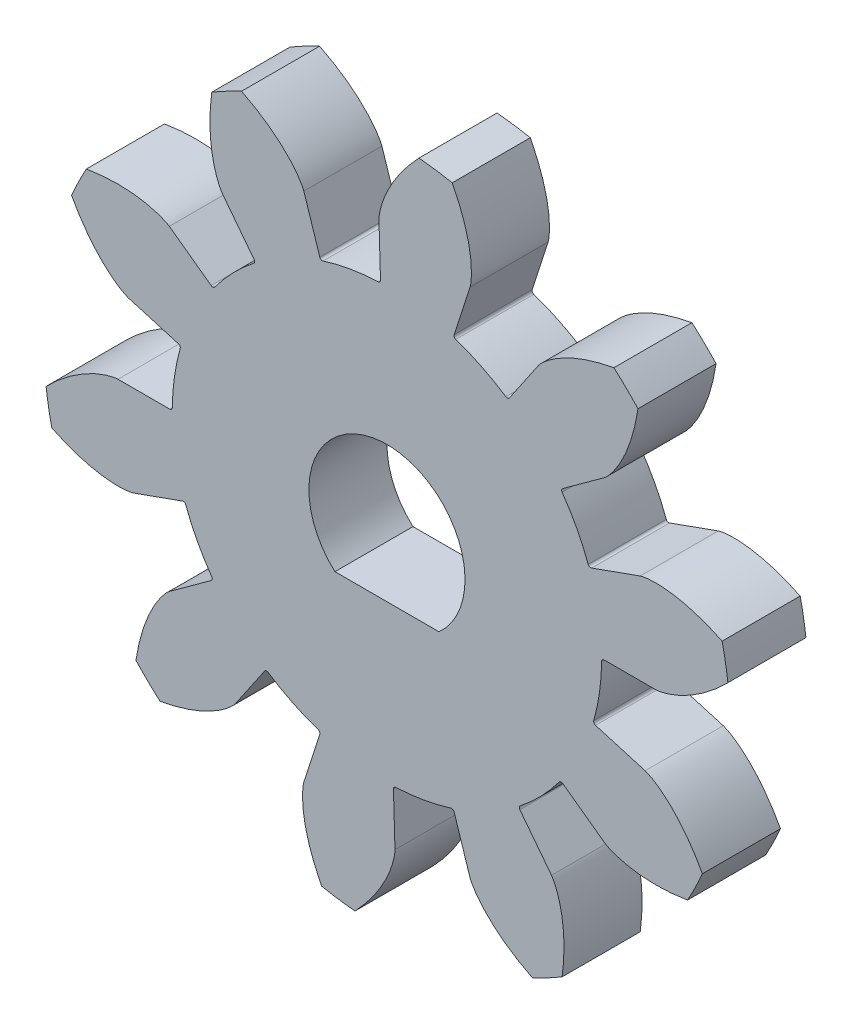
from build123d import *

# Parameters (mm, degrees)
SKETCH1_R                = 13.201320132
BOSS_EXTRUDE1_DEPTH      = 3
CUT_EXTRUDE1_DEPTH       = 19.908984808
FILLET2_R                = 0.1
FILLET4_R                = 0.1
CIRPATTERN2_COUNT        = 10
FILLET2_OF_CIRPATTERN2_R = 0.1
FILLET4_OF_CIRPATTERN2_R = 0.1


with BuildPart() as part:
    # Sketch1 → Boss-Extrude1 (new body)
    with BuildSketch(Plane.XY):
        Circle(SKETCH1_R)
        with BuildLine():
            Line((-2, -2.236067977), (2, -2.236067977))
            ThreePointArc((2, -2.236067977), (0, 3), (-2, -2.236067977))
        make_face(mode=Mode.SUBTRACT)
    extrude(amount=BOSS_EXTRUDE1_DEPTH)

    # Sketch3 → Cut-Extrude1 (cut, symmetric)
    with BuildSketch(Plane.XY):
        with BuildLine():
            Line((10.337652594, 0), (8.250825083, 0))
            ThreePointArc((8.250825083, 0), (8.167575188, -1.169115091), (7.919505467, -2.314637702))
            Line((7.919505467, -2.314637702), (9.922534464, -2.900063958))
            add(Edge.make_bspline(
                [(9.922534464, -2.900063958), (9.927206125, -2.901515605), (9.940231464, -2.905831523), (9.964542568, -2.914953615), (10.003718484, -2.931189246), (10.052873822, -2.95384659), (10.115466839, -2.985366411), (10.187930916, -3.025341959), (10.266156374, -3.072215626), (10.349661337, -3.126342525), (10.431493465, -3.183075873), (10.511695702, -3.242179083), (10.590264579, -3.30329625), (10.683813306, -3.379935207), (10.793692438, -3.475432389), (10.918632959, -3.592180063), (11.056099487, -3.730552932), (11.191474863, -3.877770971), (11.320734374, -4.027667366), (11.446611794, -4.184713223), (11.565043609, -4.340618491), (11.683008246, -4.508045123), (11.789340352, -4.665402955), (11.90269365, -4.847535183), (11.986598518, -4.986474132), (12.065099568, -5.127181289), (12.10498425, -5.200322366), (12.121049427, -5.230202101)],
                knots=[0, 0, 0, 0, 0, 0.005376749, 0.015083688, 0.02853182, 0.046610139, 0.064854849, 0.092110525, 0.119476176, 0.146842496, 0.174208854, 0.201574956, 0.228941013, 0.256307345, 0.307035032, 0.361767352, 0.41649966, 0.471231936, 0.525964282, 0.580696615, 0.635428982, 0.690161387, 0.744893688, 0.799626082, 0.854358408, 0.894707215, 0.894707215, 0.894707215, 0.894707215, 0.894707215], degree=4))
            ThreePointArc((12.121049427, -5.230202101), (12.928431982, -2.670299553), (13.201320132, 0))
            ThreePointArc((13.201320132, 0), (13.176358327, 0.81143975), (13.10156731, 1.619810868))
            add(Edge.make_bspline(
                [(10.337652594, 0), (10.342543897, 8.2795e-05), (10.356256953, 0.000571352), (10.382150879, 0.002507044), (10.424308298, 0.007100537), (10.477845914, 0.015058307), (10.546767835, 0.027752944), (10.627536553, 0.045794593), (10.715770456, 0.068841097), (10.811106639, 0.097368491), (10.905568358, 0.128866956), (10.999130465, 0.16309736), (11.091689784, 0.199719061), (11.202981814, 0.247036903), (11.335238862, 0.307874463), (11.487913981, 0.38488395), (11.658678719, 0.479136279), (11.829917648, 0.582465232), (11.996037671, 0.690080697), (12.160917082, 0.805507323), (12.318329899, 0.921927908), (12.478526433, 1.049538265), (12.62473291, 1.170747464), (12.784628699, 1.313766538), (12.9041414, 1.423588088), (13.01896332, 1.536622796), (13.077764961, 1.595637812), (13.10156731, 1.619810868)],
                knots=[0, 0, 0, 0, 0, 0.005376749, 0.015083688, 0.02853182, 0.046610139, 0.064854849, 0.092110525, 0.119476176, 0.146842496, 0.174208854, 0.201574956, 0.228941013, 0.256307345, 0.307035032, 0.361767352, 0.41649966, 0.471231936, 0.525964282, 0.580696615, 0.635428982, 0.690161387, 0.744893688, 0.799626082, 0.854358408, 0.894707215, 0.894707215, 0.894707215, 0.894707215, 0.894707215], degree=4))
        make_face()
    cut_extrude1 = extrude(amount=CUT_EXTRUDE1_DEPTH, both=True, mode=Mode.SUBTRACT)

    # Fillet2
    fillet2_edges = [part.edges().sort_by_distance(p)[0] for p in [
        (8.250825083, 0, 1.5),
    ]]
    fillet(fillet2_edges, radius=FILLET2_R)

    # Fillet4
    fillet4_edges = [part.edges().sort_by_distance(p)[0] for p in [
        (7.919505467, -2.314637702, 1.5),
    ]]
    fillet(fillet4_edges, radius=FILLET4_R)

    # CirPattern2: Cut-Extrude1 ×10 about axis
    cirpattern2_axis = Axis((0, 0, 3), (0, 0, -1))
    for i in range(1, CIRPATTERN2_COUNT):
        add(cut_extrude1.rotate(cirpattern2_axis, i * 360 / CIRPATTERN2_COUNT), mode=Mode.SUBTRACT)

    # Fillet2 of CirPattern2
    fillet2_of_cirpattern2_edges = [part.edges().sort_by_distance(p)[0] for p in [
        (6.675057709, -4.849713303, 1.5),
        (2.549645168, -7.84700096, 1.5),
        (-2.549645168, -7.84700096, 1.5),
        (-6.675057709, -4.849713303, 1.5),
        (-8.250825083, 0, 1.5),
        (-6.675057709, 4.849713303, 1.5),
        (-2.549645168, 7.84700096, 1.5),
        (2.549645168, 7.84700096, 1.5),
        (6.675057709, 4.849713303, 1.5),
    ]]
    fillet(fillet2_of_cirpattern2_edges, radius=FILLET2_OF_CIRPATTERN2_R)

    # Fillet4 of CirPattern2
    fillet4_of_cirpattern2_edges = [part.edges().sort_by_distance(p)[0] for p in [
        (5.046504604, -6.527549756, 1.5),
        (0.245910507, -8.247159666, 1.5),
        (-4.648613046, -6.816634895, 1.5),
        (-7.767524416, -2.782387282, 1.5),
        (-7.919505467, 2.314637702, 1.5),
        (-5.046504604, 6.527549756, 1.5),
        (-0.245910507, 8.247159666, 1.5),
        (4.648613046, 6.816634895, 1.5),
        (7.767524416, 2.782387282, 1.5),
    ]]
    fillet(fillet4_of_cirpattern2_edges, radius=FILLET4_OF_CIRPATTERN2_R)


solid = part.part
